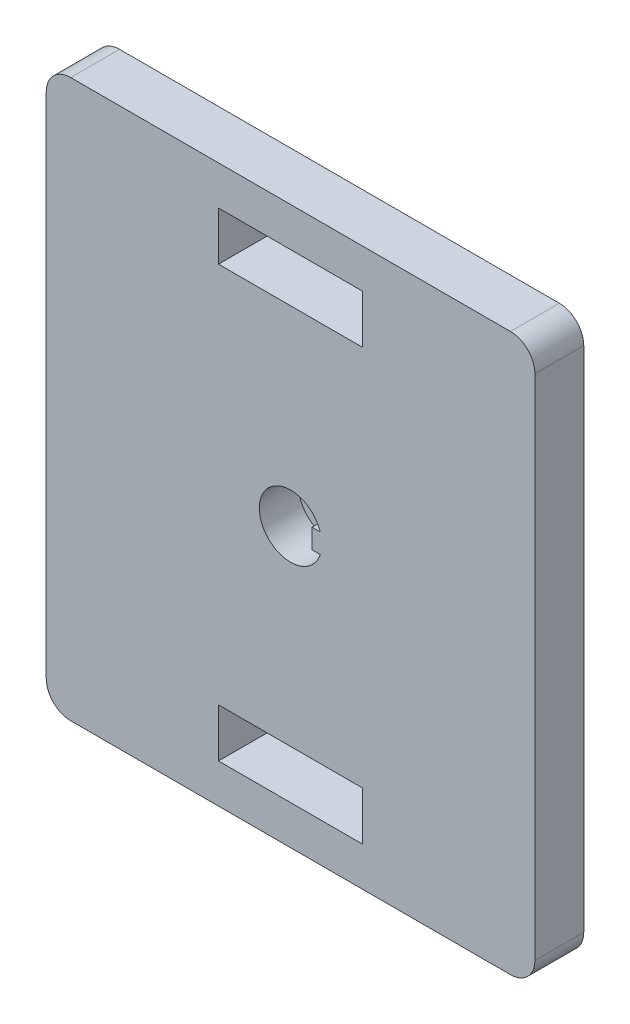
from build123d import *

# Parameters (mm, degrees)
IZIM1_W                     = 100
IZIM1_H                     = 114
Y_KSEKLIK_EKSTR_ZYON1_DEPTH = 10
IZIM2_W                     = 29.5
IZIM2_H                     = 9.95
KES_EKSTR_ZYON1_DEPTH       = 152.973681932
IZIM3_W                     = 29.5
IZIM3_H                     = 9.95
KES_EKSTR_ZYON2_DEPTH       = 152.973681932
RADYUS1_R                   = 5
KES_EKSTR_ZYON3_DEPTH       = 8


with BuildPart() as part:
    # Çizim1 → Yükseklik-Ekstrüzyon1 (new body)
    with BuildSketch(Plane.XY.offset(10)):
        with Locations((50, 57)):
            Rectangle(IZIM1_W, IZIM1_H)
    extrude(amount=-Y_KSEKLIK_EKSTR_ZYON1_DEPTH)

    # Çizim2 → Kes-Ekstrüzyon1 (cut, through all)
    with BuildSketch(Plane.XY.offset(10)):
        with Locations((50, 101.025)):
            Rectangle(IZIM2_W, IZIM2_H)
    extrude(amount=-KES_EKSTR_ZYON1_DEPTH, mode=Mode.SUBTRACT)

    # Çizim3 → Kes-Ekstrüzyon2 (cut, through all)
    with BuildSketch(Plane(origin=(0, 0, 0), x_dir=(-1, 0, 0), z_dir=(0, 0, -1))):
        with Locations((-50, 12.975)):
            Rectangle(IZIM3_W, IZIM3_H)
    extrude(amount=-KES_EKSTR_ZYON2_DEPTH, mode=Mode.SUBTRACT)

    # Radyus1
    radyus1_edges = [part.edges().sort_by_distance(p)[0] for p in [
        (0, 114, 5),
        (100, 114, 5),
        (100, 0, 5),
        (0, 0, 5),
    ]]
    fillet(radyus1_edges, radius=RADYUS1_R)

    # Çizim14 → Kes-Ekstrüzyon3 (cut)
    with BuildSketch(Plane.XY.offset(10)):
        with BuildLine():
            Line((54.4, 59), (54.4, 55))
            Line((54.4, 55), (56.079473661, 55))
            ThreePointArc((56.079473661, 55), (43.6, 57), (56.079473661, 59))
            Line((56.079473661, 59), (54.4, 59))
        make_face()
    extrude(amount=-KES_EKSTR_ZYON3_DEPTH, mode=Mode.SUBTRACT)


solid = part.part
